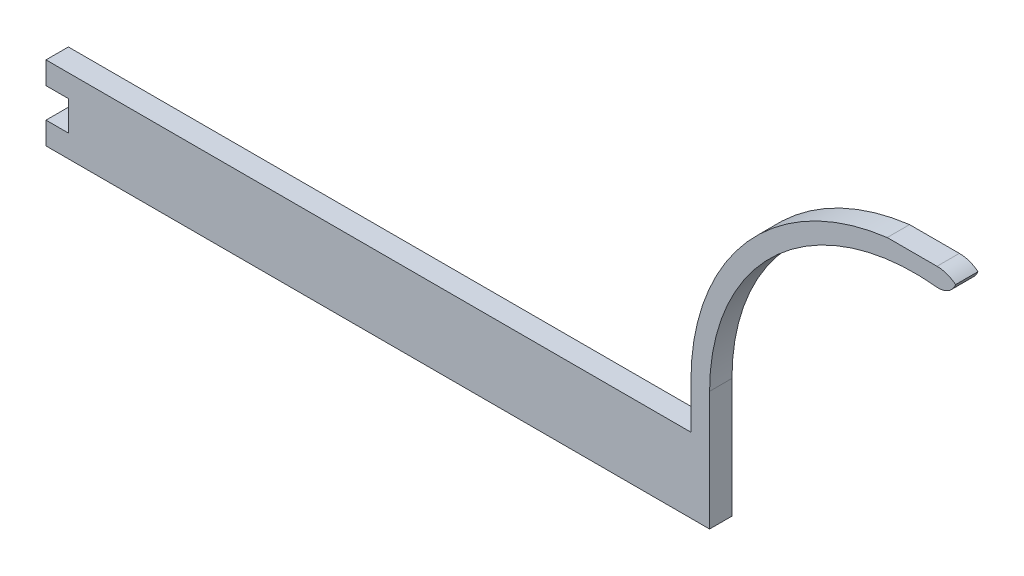
from build123d import *

# Parameters (mm, degrees)
EXTRUDE_1_DEPTH = 6


with BuildPart() as part:
    # Эскиз2 → Бобышка-Вытянуть1 (new body)
    with BuildSketch(Plane.XY):
        with BuildLine():
            Line((0, 20), (167, 20))
            Line((167, 20), (167, 32))
            ThreePointArc((167, 32), (182.048214587, 71.740873017), (219.644566271, 91.547439867))
            Line((219.644566271, 91.547439867), (233, 91.547439867))
            ThreePointArc((233, 91.547439867), (235.649529771, 91.095949123), (238, 89.792437865))
            ThreePointArc((238, 89.792437865), (235.982168822, 87.370794766), (232.906213145, 86.681959057))
            ThreePointArc((232.906213145, 86.681959057), (190.256576935, 72.925797017), (172, 32))
            Line((172, 32), (172, 0))
            Line((172, 0), (0, 0))
            Line((0, 0), (-6, 0))
            Line((-6, 0), (-6, 6))
            Line((-6, 6), (0, 6))
            Line((0, 6), (0, 14))
            Line((0, 14), (-6, 14))
            Line((-6, 14), (-6, 20))
            Line((-6, 20), (0, 20))
        make_face()
    extrude(amount=EXTRUDE_1_DEPTH)


solid = part.part
